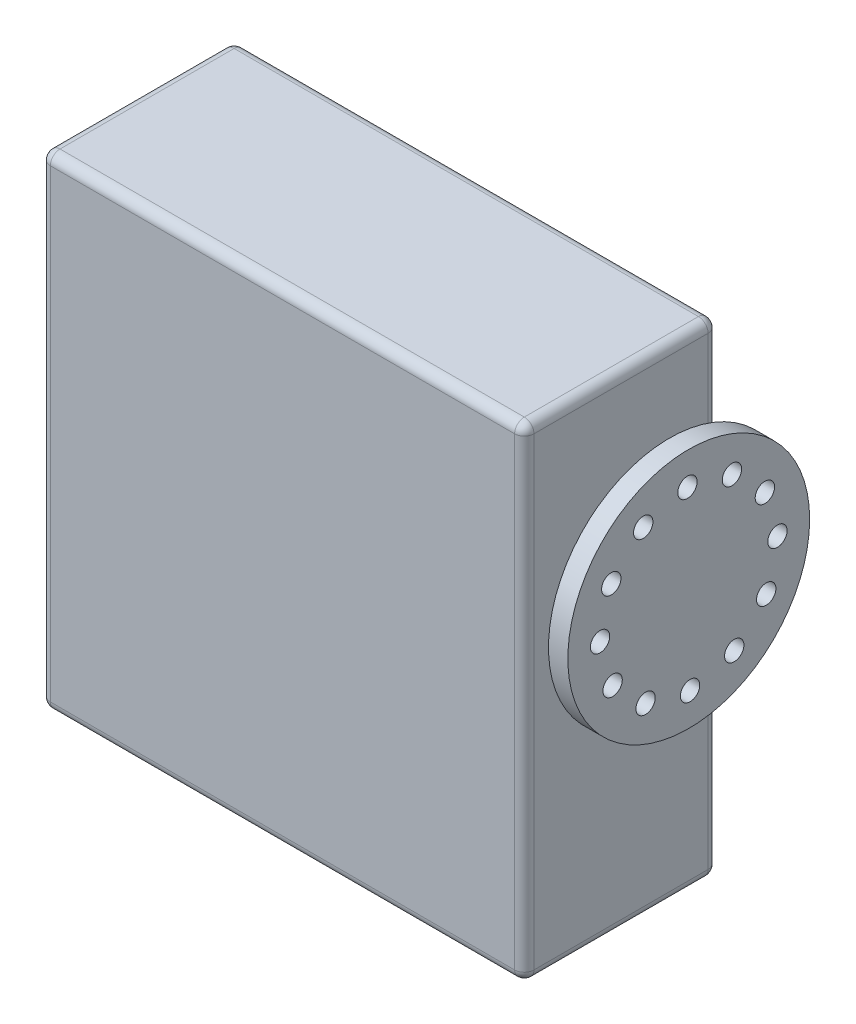
from build123d import *

# Parameters (mm, degrees)
SKETCH1_W           = 50
SKETCH1_H           = 50
BOSS_EXTRUDE1_DEPTH = 20
SKETCH2_R           = 2.5
BOSS_EXTRUDE2_DEPTH = 5
SKETCH3_R           = 12.5
BOSS_EXTRUDE3_DEPTH = 2
FILLET1_R           = 1
CIRPATTERN1_COUNT   = 12


with BuildPart() as part:
    # Sketch1 → Boss-Extrude1 (new body)
    with BuildSketch(Plane.XY):
        with Locations((25, 25)):
            Rectangle(SKETCH1_W, SKETCH1_H)
    extrude(amount=BOSS_EXTRUDE1_DEPTH)

    # Sketch2 → Boss-Extrude2 (add)
    with BuildSketch(Plane(origin=(50, 0, 0), x_dir=(0, 0, -1), z_dir=(1, 0, 0))):
        with Locations(Location((-10, 34.113262312, 0), (0, 0, 180))):
            Circle(SKETCH2_R)
    extrude(amount=BOSS_EXTRUDE2_DEPTH)

    # Sketch3 → Boss-Extrude3 (add)
    with BuildSketch(Plane(origin=(55, 0, 0), x_dir=(0, 0, -1), z_dir=(1, 0, 0))):
        with Locations((-10, 34.113262312)):
            Circle(SKETCH3_R)
    extrude(amount=BOSS_EXTRUDE3_DEPTH)

    # Fillet1
    fillet1_edges = [part.edges().sort_by_distance(p)[0] for p in [
        (50, 25, 20),
        (25, 50, 20),
        (0, 25, 20),
        (25, 50, 0),
        (50, 25, 0),
        (25, 0, 0),
        (0, 25, 0),
        (25, 0, 20),
        (0, 50, 10),
        (50, 50, 10),
        (50, 0, 10),
        (0, 0, 10),
    ]]
    fillet(fillet1_edges, radius=FILLET1_R)

    # Sketch4 → Ø2.0mm Dowel Hole1 (revolve, cut)
    with BuildSketch(Plane(origin=(57, 34.25166224, 0.83161613), x_dir=(0, 0, -1), z_dir=(0, 1, 0))):
        Polygon((0, 0), (0, 2.600860619), (1, 2), (1, 0), align=None)
    f_2_0mm_dowel_hole1 = revolve(axis=Axis((63.35, 34.25166224, 0.83161613), (-1, 0, 0)), mode=Mode.SUBTRACT)

    # CirPattern1: Ø2.0mm Dowel Hole1 ×12 about axis
    cirpattern1_axis = Axis((0, 34.113262312, 10), (1, 0, 0))
    for i in range(1, CIRPATTERN1_COUNT):
        add(f_2_0mm_dowel_hole1.rotate(cirpattern1_axis, i * 360 / CIRPATTERN1_COUNT), mode=Mode.SUBTRACT)


solid = part.part
